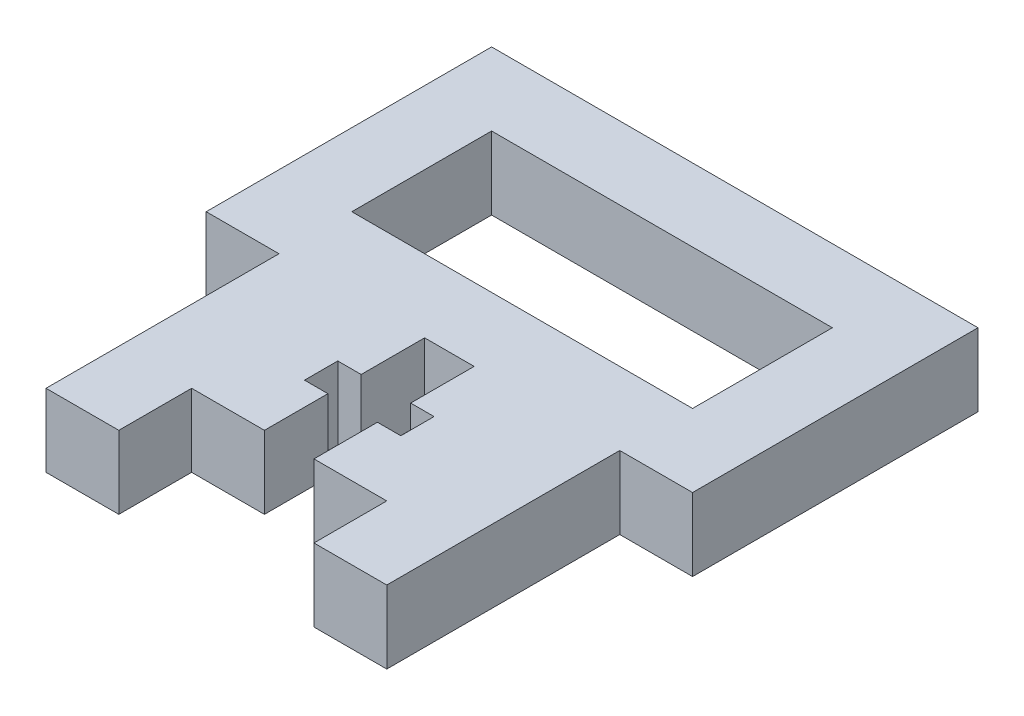
from build123d import *

# Parameters (mm, degrees)
SKETCH1_W           = 29.718
SKETCH1_H           = 12.192
BOSS_EXTRUDE1_DEPTH = 6.35


with BuildPart() as part:
    # Sketch1 → Boss-Extrude1 (new body)
    with BuildSketch(Plane(origin=(0, 0, 0), x_dir=(1, 0, 0), z_dir=(0, 1, 0))):
        Polygon((-21.209, 12.446), (-21.209, -12.446), (-14.859, -12.446), (-14.859, -26.416), (-14.859, -32.766), (-8.509, -32.766), (-8.509, -26.416), (-2.159, -26.416), (-2.159, -20.881000021), (-4.199999982, -20.881000021), (-4.199999982, -17.980999979), (-2.159, -17.980999979), (-2.159, -12.446), (2.159, -12.446), (2.159, -17.980999979), (4.199999982, -17.980999979), (4.199999982, -20.881000021), (2.159, -20.881000021), (2.159, -26.416), (8.509, -26.416), (8.509, -32.766), (14.859, -32.766), (14.859, -26.416), (14.859, -12.446), (21.209, -12.446), (21.209, 12.446), align=None)
        Rectangle(SKETCH1_W, SKETCH1_H, mode=Mode.SUBTRACT)
    extrude(amount=BOSS_EXTRUDE1_DEPTH)


solid = part.part
